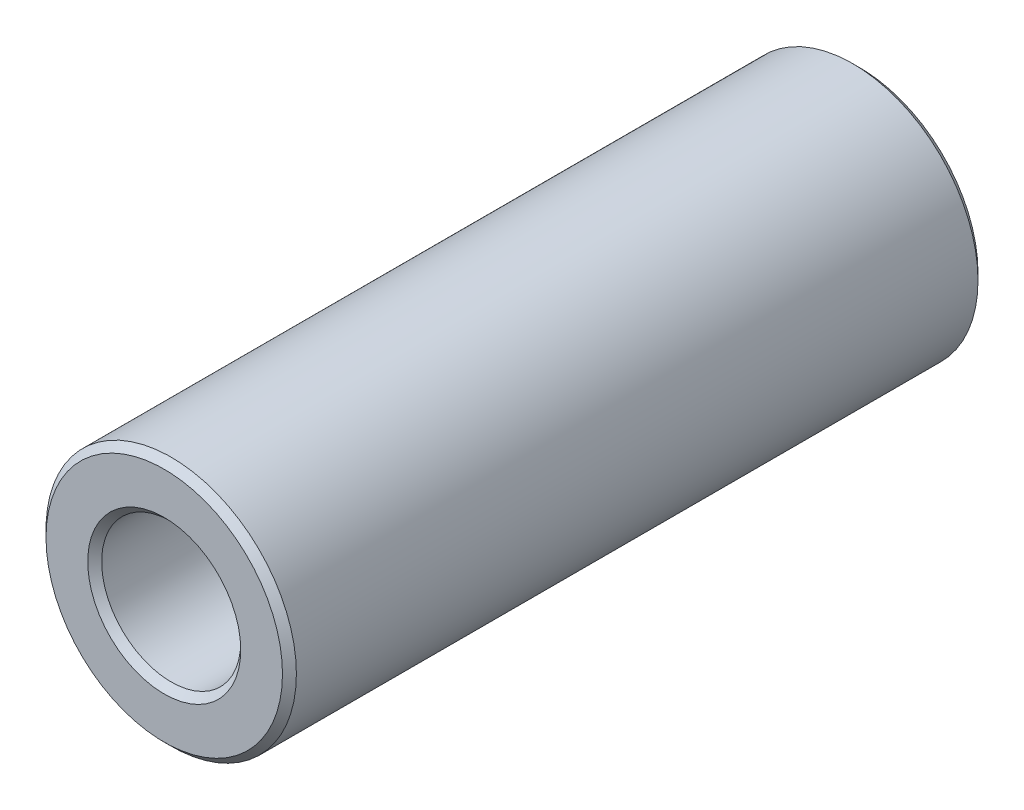
from build123d import *

# Parameters (mm, degrees)
SKETCH1_R           = 9
SKETCH1_R_2         = 5
BOSS_EXTRUDE1_DEPTH = 50
CHAMFER1_SIZE       = 0.5


with BuildPart() as part:
    # Sketch1 → Boss-Extrude1 (new body)
    with BuildSketch(Plane.XY):
        Circle(SKETCH1_R)
        Circle(SKETCH1_R_2, mode=Mode.SUBTRACT)
    extrude(amount=BOSS_EXTRUDE1_DEPTH)

    # Chamfer1
    chamfer1_edges = [part.edges().sort_by_distance(p)[0] for p in [
        (-9, 0, 0),
        (-9, 0, 50),
        (-5, 0, 0),
        (-5, 0, 50),
    ]]
    chamfer(chamfer1_edges, length=CHAMFER1_SIZE)


solid = part.part
